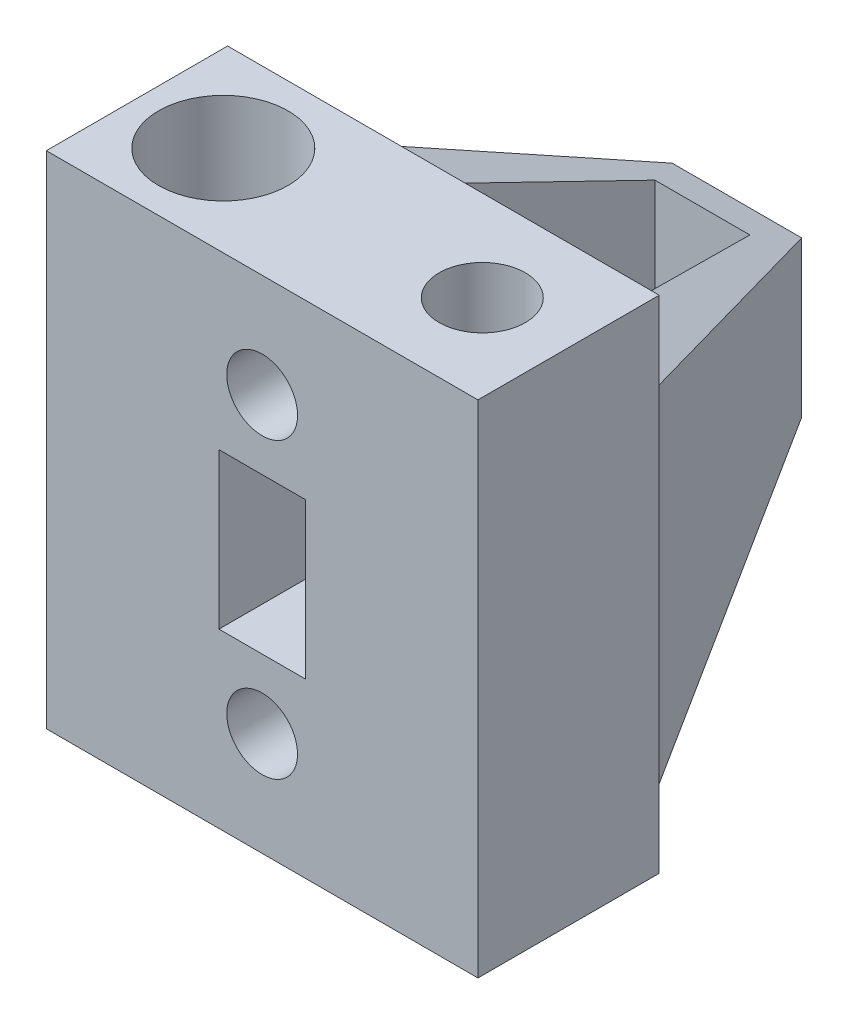
from build123d import *

# Parameters (mm, degrees)
SKETCH1_W           = 50
SKETCH1_H           = 21
BOSS_EXTRUDE1_DEPTH = 58
SKETCH3_R           = 7.5
CUT_EXTRUDE1_DEPTH  = 24
CUT_EXTRUDE2_REACH  = 66.025
SKETCH4_R           = 5
CUT_EXTRUDE3_START  = -24
SKETCH5_R           = 7.5
CUT_EXTRUDE3_DEPTH  = 24
CUT_EXTRUDE4_REACH  = 66.025
SKETCH6_R           = 4.5
CUT_EXTRUDE5_REACH  = 68.558
SKETCH8_W           = 10
SKETCH8_H           = 18
BOSS_EXTRUDE3_DEPTH = 20
CUT_EXTRUDE6_DEPTH  = 37.5
CUT_EXTRUDE7_REACH  = 85.75
SKETCH13_R          = 2
SKETCH7_R           = 4.1
CUT_EXTRUDE8_DEPTH  = 15


with BuildPart() as part:
    # Sketch1 → Boss-Extrude1 (new body)
    with BuildSketch(Plane(origin=(0, 0, 0), x_dir=(1, 0, 0), z_dir=(0, 1, 0))):
        Rectangle(SKETCH1_W, SKETCH1_H)
    extrude(amount=BOSS_EXTRUDE1_DEPTH)

    # Sketch3 → Cut-Extrude1 (cut)
    with BuildSketch(Plane(origin=(0, 58, 0), x_dir=(1, 0, 0), z_dir=(0, 1, 0))):
        with Locations(Location((-15, 0, 0), (0, 0, 270))):
            Circle(SKETCH3_R)
    extrude(amount=-CUT_EXTRUDE1_DEPTH, mode=Mode.SUBTRACT)

    # Sketch4 → Cut-Extrude2 (cut, up to next)
    with BuildSketch(Plane(origin=(0, 58, 0), x_dir=(1, 0, 0), z_dir=(0, 1, 0)), mode=Mode.PRIVATE) as cut_extrude2_sk1:
        with Locations(Location((15, 0, 0), (0, 0, 270))):
            Circle(SKETCH4_R)
    cut_extrude2_tool1 = extrude(cut_extrude2_sk1.sketch, amount=-CUT_EXTRUDE2_REACH, mode=Mode.PRIVATE) & part.part
    add(cut_extrude2_tool1.solids().sort_by_distance((15, 58, 0))[0], mode=Mode.SUBTRACT)

    # Sketch5 → Cut-Extrude3 (cut)
    with BuildSketch(Plane.XZ.offset(CUT_EXTRUDE3_START)):
        with Locations(Location((-15, 0, 0), (0, 0, 90))):
            Circle(SKETCH5_R)
    extrude(amount=CUT_EXTRUDE3_DEPTH, mode=Mode.SUBTRACT)

    # Sketch6 → Cut-Extrude4 (cut, up to next)
    with BuildSketch(Plane.XZ, mode=Mode.PRIVATE) as cut_extrude4_sk1:
        with Locations(Location((-15, 0, 0), (0, 0, 270))):
            Circle(SKETCH6_R)
    cut_extrude4_tool1 = extrude(cut_extrude4_sk1.sketch, amount=-CUT_EXTRUDE4_REACH, mode=Mode.PRIVATE) & part.part
    add(cut_extrude4_tool1.solids().sort_by_distance((-15, 0, 0))[0], mode=Mode.SUBTRACT)

    # Sketch8 → Cut-Extrude5 (cut, up to next)
    with BuildSketch(Plane.XY.offset(10.5), mode=Mode.PRIVATE) as cut_extrude5_sk1:
        with Locations((0, 29)):
            Rectangle(SKETCH8_W, SKETCH8_H)
    cut_extrude5_tool1 = extrude(cut_extrude5_sk1.sketch, amount=-CUT_EXTRUDE5_REACH, mode=Mode.PRIVATE) & part.part
    add(cut_extrude5_tool1.solids().sort_by_distance((0, 29, 10.5))[0], mode=Mode.SUBTRACT)

    # Sketch11 → Boss-Extrude3 (add, symmetric)
    with BuildSketch(Plane(origin=(0, 29, 0), x_dir=(0, 0, -1), z_dir=(0, 1, 0))):
        Polygon((40.5, 5.5), (40.5, -5.5), (10.5, -15), (10.5, -25), (44.5, -7.5), (44.5, 7.5), (10.5, 25), (10.5, 15), align=None)
    extrude(amount=BOSS_EXTRUDE3_DEPTH, both=True)

    # Sketch12 → Cut-Extrude6 (cut, symmetric)
    with BuildSketch(Plane.ZY):
        Polygon((-44.5, 38), (-10.5, 49), (-44.5, 49), align=None)
        Polygon((-44.5, 20), (-10.5, 9), (-44.5, 9), align=None)
    extrude(amount=CUT_EXTRUDE6_DEPTH, both=True, mode=Mode.SUBTRACT)

    # Sketch13 → Cut-Extrude7 (cut, up to next)
    with BuildSketch(Plane(origin=(0, 0, -44.5), x_dir=(-1, 0, 0), z_dir=(0, 0, -1)), mode=Mode.PRIVATE) as cut_extrude7_sk1:
        with Locations((0, 29)):
            Circle(SKETCH13_R)
    cut_extrude7_tool1 = extrude(cut_extrude7_sk1.sketch, amount=-CUT_EXTRUDE7_REACH, mode=Mode.PRIVATE) & part.part
    add(cut_extrude7_tool1.solids().sort_by_distance((0, 29, -44.5))[0], mode=Mode.SUBTRACT)

    # Sketch7 → Cut-Extrude8 (cut)
    with BuildSketch(Plane.XY.offset(10.5)):
        with Locations((0, 46)):
            Circle(SKETCH7_R)
        with Locations(Location((0, 12, 0), (0, 0, 180))):
            Circle(SKETCH7_R)
    extrude(amount=-CUT_EXTRUDE8_DEPTH, mode=Mode.SUBTRACT)


solid = part.part
